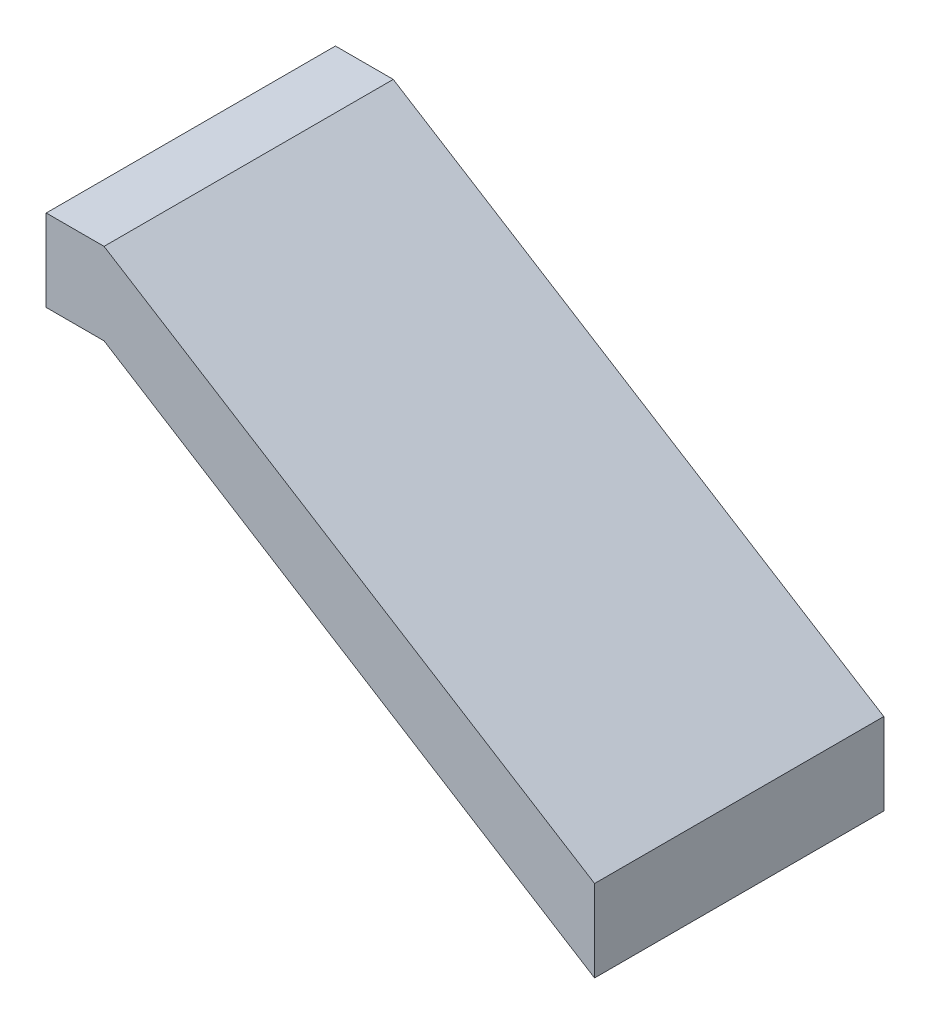
from build123d import *

# Parameters (mm, degrees)
ACTIVE_SAND_LAYER_NORMAL_120_DEPTH = 500


with BuildPart() as part:
    # 草图1 → Active_sand_layer_normal_120 (new body)
    with BuildSketch(Plane.XY):
        Polygon((50, 609.919264233), (150, 609.919264233), (998.048096156, 80), (998.048096156, 221.501408403), (150, 751.420672637), (50, 751.420672637), align=None)
    extrude(amount=ACTIVE_SAND_LAYER_NORMAL_120_DEPTH)


solid = part.part
